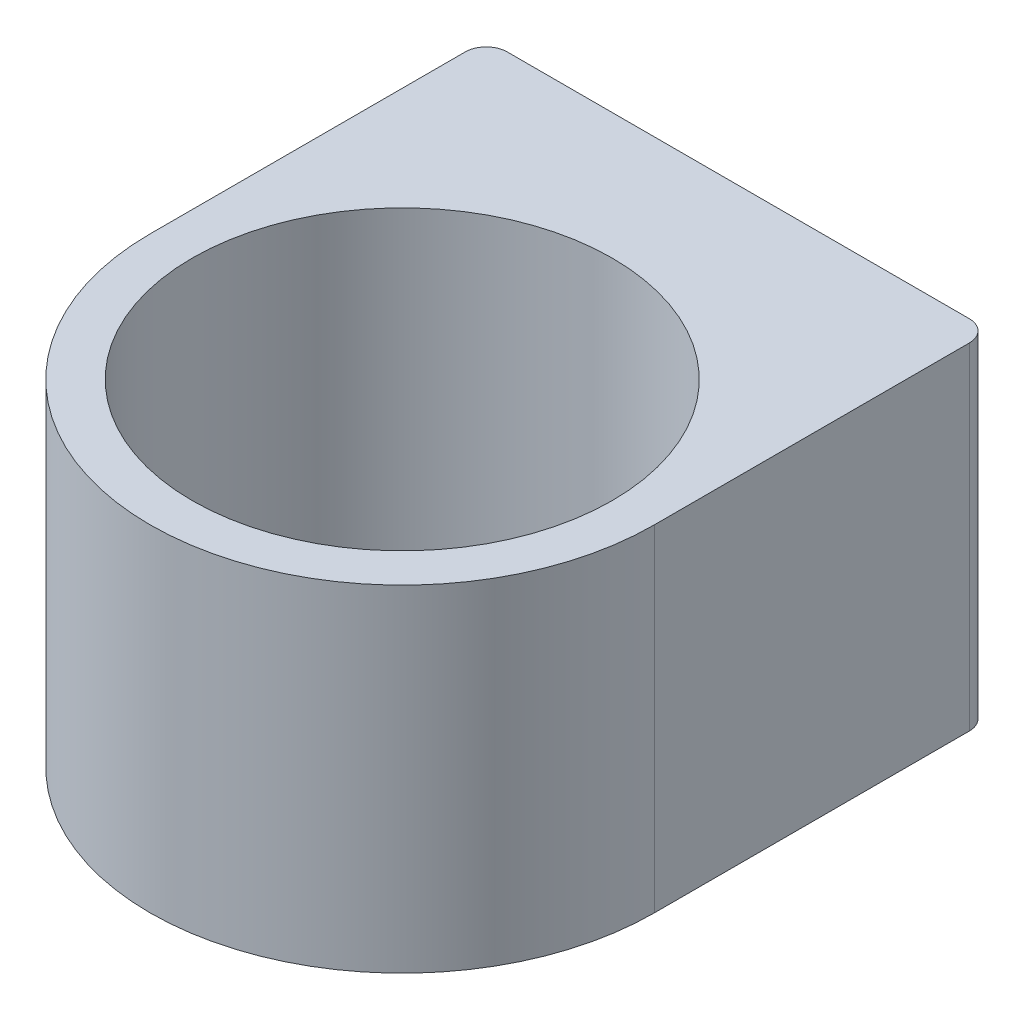
from build123d import *

# Parameters (mm, degrees)
SKETCH1_R           = 50
BOSS_EXTRUDE1_DEPTH = 40
FILLET1_R           = 5
SKETCH2_R           = 20
BOSS_EXTRUDE2_DEPTH = 20
SKETCH7_R           = 16.5
CUT_EXTRUDE1_DEPTH  = 20


with BuildPart() as part:
    # Sketch1 → Boss-Extrude1 (new, symmetric)
    with BuildSketch(Plane(origin=(0, 0, 0), x_dir=(1, 0, 0), z_dir=(0, 1, 0))):
        with BuildLine():
            Line((-60, 0), (-60, 80))
            Line((-60, 80), (60, 80))
            Line((60, 80), (60, 0))
            ThreePointArc((60, 0), (0, -60), (-60, 0))
        make_face()
        with Locations(Location((0, 0, 0), (0, 0, 270))):
            Circle(SKETCH1_R, mode=Mode.SUBTRACT)
    extrude(amount=BOSS_EXTRUDE1_DEPTH, both=True)

    # Fillet1
    fillet1_edges = [part.edges().sort_by_distance(p)[0] for p in [
        (-60, 0, -80),
        (60, 0, -80),
    ]]
    fillet(fillet1_edges, radius=FILLET1_R)

    # Sketch2 → Boss-Extrude2 (add)
    with BuildSketch(Plane(origin=(0, 0, -80), x_dir=(-1, 0, 0), z_dir=(0, 0, -1))):
        with Locations(Location((0, 0, 0), (0, 0, 180))):
            Circle(SKETCH2_R)
    extrude(amount=BOSS_EXTRUDE2_DEPTH)

    # Sketch7 → Cut-Extrude1 (cut)
    with BuildSketch(Plane(origin=(0, 0, -100), x_dir=(-1, 0, 0), z_dir=(0, 0, -1))):
        Circle(SKETCH7_R)
    extrude(amount=-CUT_EXTRUDE1_DEPTH, mode=Mode.SUBTRACT)


solid = part.part
